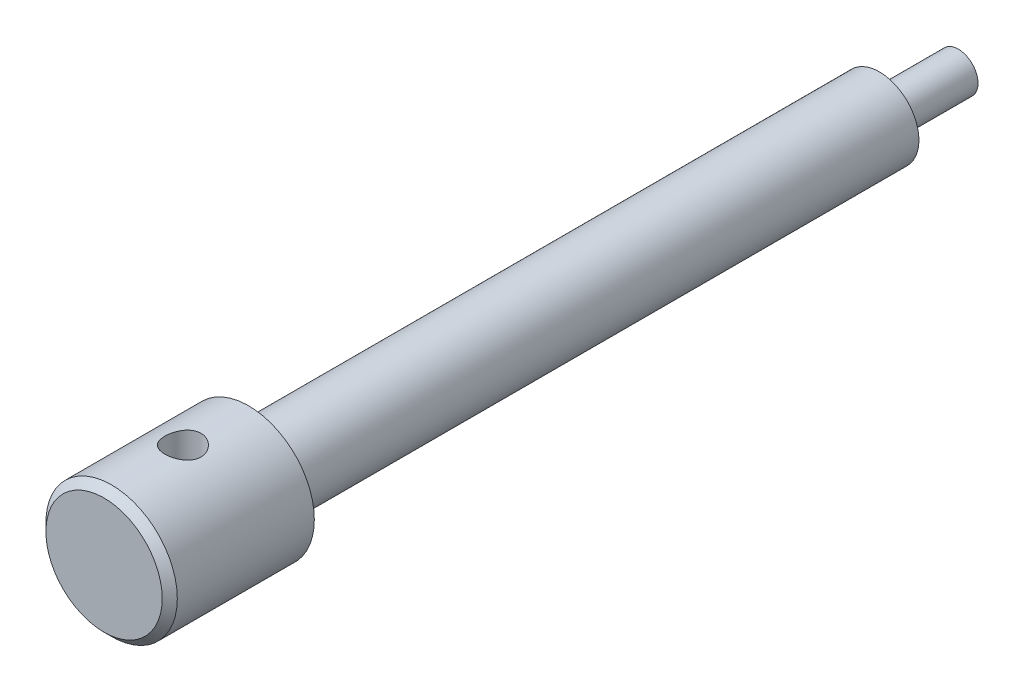
from build123d import *

# Parameters (mm, degrees)
SKETCH3_R               = 10
BOSS_EXTRUDE1_DEPTH     = 22
SKETCH4_R               = 6
BOSS_EXTRUDE2_DEPTH     = 96
SKETCH5_R               = 3
BOSS_EXTRUDE3_DEPTH     = 12
CUT_EXTRUDE2_DEPTH      = 131.766968306
CUT_EXTRUDE2_DEPTH_BACK = 131.766968306
SKETCH6_R               = 2.75
CHAMFER1_SIZE           = 1.15


with BuildPart() as part:
    # Sketch3 → Boss-Extrude1 (new body)
    with BuildSketch(Plane.XY):
        Circle(SKETCH3_R)
    extrude(amount=-BOSS_EXTRUDE1_DEPTH)

    # Sketch4 → Boss-Extrude2 (add)
    with BuildSketch(Plane(origin=(0, 0, -22), x_dir=(-1, 0, 0), z_dir=(0, 0, -1))):
        Circle(SKETCH4_R)
    extrude(amount=BOSS_EXTRUDE2_DEPTH)

    # Sketch5 → Boss-Extrude3 (add)
    with BuildSketch(Plane(origin=(0, 0, -118), x_dir=(-1, 0, 0), z_dir=(0, 0, -1))):
        Circle(SKETCH5_R)
    extrude(amount=BOSS_EXTRUDE3_DEPTH)

    # Sketch6 → Cut-Extrude2 (cut, two sides: drawn at the far end of the back side and taken through both)
    with BuildSketch(Plane(origin=(0, 0, 0), x_dir=(1, 0, 0), z_dir=(0, 1, 0)).offset(-CUT_EXTRUDE2_DEPTH_BACK)):
        with Locations(Location((0, 12, 0), (0, 0, 270))):
            Circle(SKETCH6_R)
    extrude(amount=CUT_EXTRUDE2_DEPTH + CUT_EXTRUDE2_DEPTH_BACK, mode=Mode.SUBTRACT)

    # Chamfer1
    chamfer1_edges = [part.edges().sort_by_distance(p)[0] for p in [
        (-10, 0, 0),
    ]]
    chamfer(chamfer1_edges, length=CHAMFER1_SIZE)


solid = part.part
